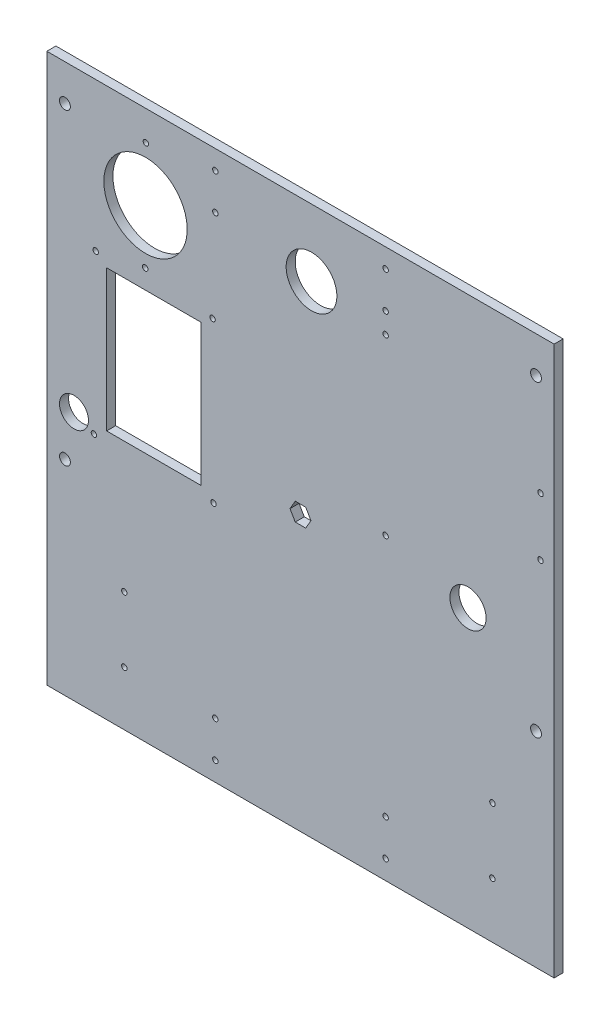
from build123d import *

# Parameters (mm, degrees)
ESQUISSE1_W              = 280
ESQUISSE1_H              = 210
BOSS_EXTRU_1_DEPTH       = 5
ESQUISSE2_R              = 3
ESQUISSE2_R_2            = 1.5
ESQUISSE2_R_3            = 8
ESQUISSE2_R_4            = 14
ESQUISSE2_R_5            = 10
ESQUISSE2_W              = 52
ESQUISSE2_H              = 78
ENL_V_MAT_EXTRU_1_DEPTH  = 351.035712464
ESQUISSE5_R              = 1.5
ENL_V_MAT_EXTRU_3_DEPTH  = 351.035712464
ESQUISSE6_W              = 280
ESQUISSE6_H              = 93
BOSS_EXTRU_4_DEPTH       = 5
ESQUISSE7_R              = 1.499999999
ENL_V_MAT_EXTRU_4_DEPTH  = 351.035712464
ESQUISSE8_R              = 1.499999999
ENL_V_MAT_EXTRU_5_DEPTH  = 351.035712464
ESQUISSE9_R              = 1.5
ENL_V_MAT_EXTRU_6_DEPTH  = 351.035712464
ESQUISSE14_R             = 23
ESQUISSE14_R_2           = 1.5
ENL_V_MAT_EXTRU_11_DEPTH = 351.035712464


with BuildPart() as part:
    # Esquisse1 → Boss.-Extru.1 (new body)
    with BuildSketch(Plane.XY):
        with Locations((140, 105)):
            Rectangle(ESQUISSE1_W, ESQUISSE1_H)
    extrude(amount=BOSS_EXTRU_1_DEPTH)

    # Esquisse2 → Enlèv. mat.-Extru.1 (cut, through all)
    with BuildSketch(Plane.XY):
        with Locations((270, 190)):
            Circle(ESQUISSE2_R)
        with Locations((10, 190)):
            Circle(ESQUISSE2_R)
        with Locations((10, 20)):
            Circle(ESQUISSE2_R)
        with Locations((270, 20)):
            Circle(ESQUISSE2_R)
        with Locations((187, 168)):
            Circle(ESQUISSE2_R_2)
        with Locations((187, 72)):
            Circle(ESQUISSE2_R_2)
        with Locations((91.5, 128)):
            Circle(ESQUISSE2_R_2)
        with Locations((27, 128)):
            Circle(ESQUISSE2_R_2)
        with Locations((92, 40)):
            Circle(ESQUISSE2_R_2)
        with Locations((26, 40)):
            Circle(ESQUISSE2_R_2)
        with Locations((15, 45)):
            Circle(ESQUISSE2_R_3)
        with Locations((146.093717203, 173)):
            Circle(ESQUISSE2_R_4)
        with Locations((232.477054828, 60.19739042)):
            Circle(ESQUISSE2_R_5)
        with Locations((272.5, 103)):
            Circle(ESQUISSE2_R_2)
        with Locations((272.5, 135)):
            Circle(ESQUISSE2_R_2)
        with Locations((59, 84)):
            Rectangle(ESQUISSE2_W, ESQUISSE2_H)
        Polygon((137.113248654, 63.5), (134.226497308, 58.5), (137.113248654, 53.5), (142.886751346, 53.5), (145.773502692, 58.5), (142.886751346, 63.5), align=None)
    extrude(amount=ENL_V_MAT_EXTRU_1_DEPTH, mode=Mode.SUBTRACT)

    # Esquisse5 → Enlèv. mat.-Extru.3 (cut, through all)
    with BuildSketch(Plane(origin=(0, 0, 0), x_dir=(-1, 0, 0), z_dir=(0, 0, -1))):
        with Locations((-93, 179.4)):
            Circle(ESQUISSE5_R)
        with Locations((-93, 199.4)):
            Circle(ESQUISSE5_R)
        with Locations((-187, 199.4)):
            Circle(ESQUISSE5_R)
        with Locations((-187, 179.4)):
            Circle(ESQUISSE5_R)
    extrude(amount=-ENL_V_MAT_EXTRU_3_DEPTH, mode=Mode.SUBTRACT)

    # Esquisse6 → Boss.-Extru.4 (add)
    with BuildSketch(Plane(origin=(0, 0, 0), x_dir=(-1, 0, 0), z_dir=(0, 0, -1))):
        with Locations((-140, -46.5)):
            Rectangle(ESQUISSE6_W, ESQUISSE6_H)
    extrude(amount=-BOSS_EXTRU_4_DEPTH)

    # Esquisse7 → Enlèv. mat.-Extru.4 (cut, through all)
    with BuildSketch(Plane(origin=(0, 0, 0), x_dir=(-1, 0, 0), z_dir=(0, 0, -1))):
        with Locations((-42.785302694, -27.055649919)):
            Circle(ESQUISSE7_R)
        with Locations((-42.773346208, -63.039616064)):
            Circle(ESQUISSE7_R)
    extrude(amount=-ENL_V_MAT_EXTRU_4_DEPTH, mode=Mode.SUBTRACT)

    # Esquisse8 → Enlèv. mat.-Extru.5 (cut, through all)
    with BuildSketch(Plane(origin=(0, 0, 0), x_dir=(-1, 0, 0), z_dir=(0, 0, -1))):
        with Locations((-245.944892864, -62.344865672)):
            Circle(ESQUISSE8_R)
        with Locations((-245.944892864, -26.360897541)):
            Circle(ESQUISSE8_R)
    extrude(amount=-ENL_V_MAT_EXTRU_5_DEPTH, mode=Mode.SUBTRACT)

    # Esquisse9 → Enlèv. mat.-Extru.6 (cut, through all)
    with BuildSketch(Plane(origin=(0, 0, 0), x_dir=(-1, 0, 0), z_dir=(0, 0, -1))):
        with Locations((-93, -62.4)):
            Circle(ESQUISSE9_R)
        with Locations((-93, -82.4)):
            Circle(ESQUISSE9_R)
        with Locations((-187, -82.4)):
            Circle(ESQUISSE9_R)
        with Locations((-187, -62.4)):
            Circle(ESQUISSE9_R)
    extrude(amount=-ENL_V_MAT_EXTRU_6_DEPTH, mode=Mode.SUBTRACT)

    # Esquisse14 → Enlèv. mat.-Extru.11 (cut, through all)
    with BuildSketch(Plane(origin=(0, 0, 0), x_dir=(-1, 0, 0), z_dir=(0, 0, -1))):
        with Locations((-54.48265068, 163.570126578)):
            Circle(ESQUISSE14_R)
        with Locations((-54.649127802, 193.569664664)):
            Circle(ESQUISSE14_R_2)
        with Locations((-54.316173557, 133.570588492)):
            Circle(ESQUISSE14_R_2)
    extrude(amount=-ENL_V_MAT_EXTRU_11_DEPTH, mode=Mode.SUBTRACT)


solid = part.part
